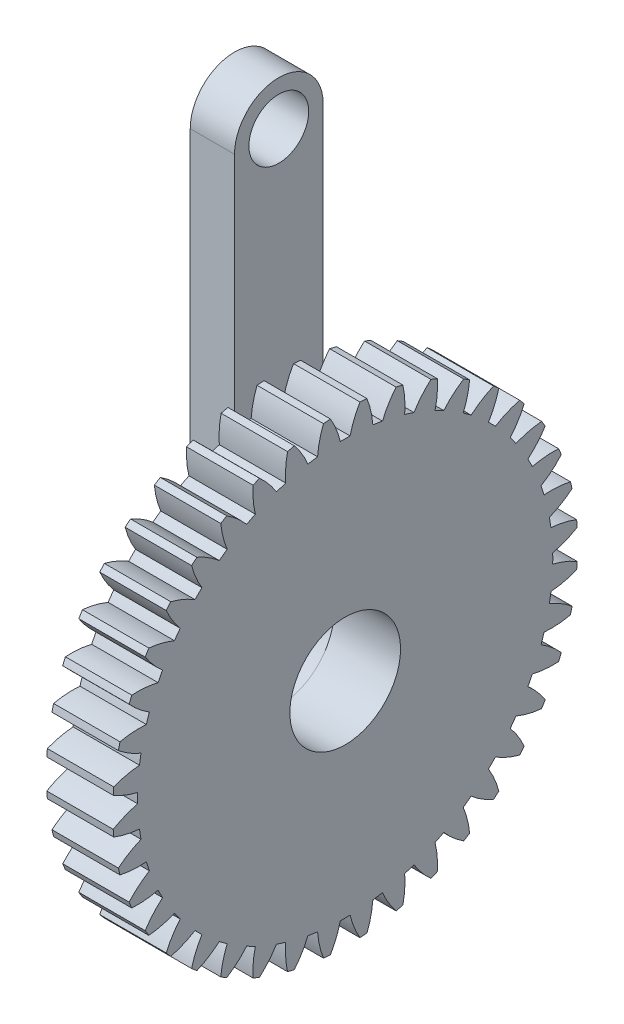
from build123d import *

# Parameters (mm, degrees)
BASPROSKE_W         = 12
BASPROSKE_H         = 42
TOOTHCUT_DEPTH      = 61.59702963
TEETHCUTS_COUNT     = 40
TEETHCUTS_ANGLE     = 351
BORSKE_R            = 0.4
BORE_DEPTH          = 50.0000508
SCALE1_SCALE        = 0.5
SKETCH1_R           = 5
CUT_EXTRUDE1_DEPTH  = 31.23990208
SKETCH2_R           = 5.2
SKETCH2_R_2         = 2.7
BOSS_EXTRUDE1_DEPTH = 4


with BuildPart() as part:
    # BasProSke → Base-Revolve (revolve)
    with BuildSketch(Plane(origin=(0, 0, 0), x_dir=(1, 0, 0), z_dir=(0, 1, 0)), mode=Mode.PRIVATE) as base_revolve_sk:
        with Locations((6, 21)):
            Rectangle(BASPROSKE_W, BASPROSKE_H)
    revolve(base_revolve_sk.sketch.rotate(Axis((-10, 0, 0), (1, 0, 0)), 180), axis=Axis((-10, 0, 0), (1, 0, 0)))

    # TooCutSke → ToothCut (cut, through all)
    with BuildSketch(Plane(origin=(0, 0, 0), x_dir=(0, 0, -1), z_dir=(1, 0, 0))):
        with BuildLine():
            ThreePointArc((0.882812088, 37.488606854), (0, 37.499), (-0.882812088, 37.488606854))
            ThreePointArc((-0.882812088, 37.488606854), (-1.612748684, 39.782000434), (-2.678427154, 41.939960338))
            ThreePointArc((-2.678427154, 41.939960338), (0, 42.0254), (2.678427154, 41.939960338))
            ThreePointArc((2.678427154, 41.939960338), (1.612748684, 39.782000434), (0.882812088, 37.488606854))
        make_face()
    toothcut = extrude(amount=TOOTHCUT_DEPTH, mode=Mode.SUBTRACT)

    # TeethCuts: ToothCut ×40 about axis
    teethcuts_axis = Axis((-10, 0, 0), (1, 0, 0))
    for i in range(1, TEETHCUTS_COUNT):
        add(toothcut.rotate(teethcuts_axis, i * TEETHCUTS_ANGLE / (TEETHCUTS_COUNT - 1)), mode=Mode.SUBTRACT)

    # BorSke → Bore (cut, symmetric)
    with BuildSketch(Plane(origin=(0, 0, 0), x_dir=(0, 0, -1), z_dir=(1, 0, 0))):
        with Locations(Location((0, 0, 0), (0, 0, 180))):
            Circle(BORSKE_R)
    extrude(amount=BORE_DEPTH, both=True, mode=Mode.SUBTRACT)


with BuildPart() as part_1:
    # Scale1: scaled about (6, 0, 0)
    add(part.part.scale(SCALE1_SCALE).moved(Location((3, 0, 0))))

    # Sketch1 → Cut-Extrude1 (cut, through all)
    with BuildSketch(Plane(origin=(9, 0, 0), x_dir=(0, 0, -1), z_dir=(1, 0, 0))):
        with Locations((0, -0.2)):
            Circle(SKETCH1_R)
    extrude(amount=-CUT_EXTRUDE1_DEPTH, mode=Mode.SUBTRACT)

    # Sketch2 → Boss-Extrude1 (add)
    with BuildSketch(Plane.ZY.offset(-3)):
        with BuildLine():
            Line((-4, 40), (-4, 6.652116812))
            ThreePointArc((-4, 6.652116812), (0, -7.762129739), (4, 6.652116812))
            Line((4, 6.652116812), (4, 40))
            ThreePointArc((4, 40), (0, 44), (-4, 40))
        make_face()
        with Locations(Location((0, 0, 0), (0, 0, 270))):
            Circle(SKETCH2_R, mode=Mode.SUBTRACT)
        with Locations((0, 40)):
            Circle(SKETCH2_R_2, mode=Mode.SUBTRACT)
    extrude(amount=BOSS_EXTRUDE1_DEPTH)


solid = part_1.part
